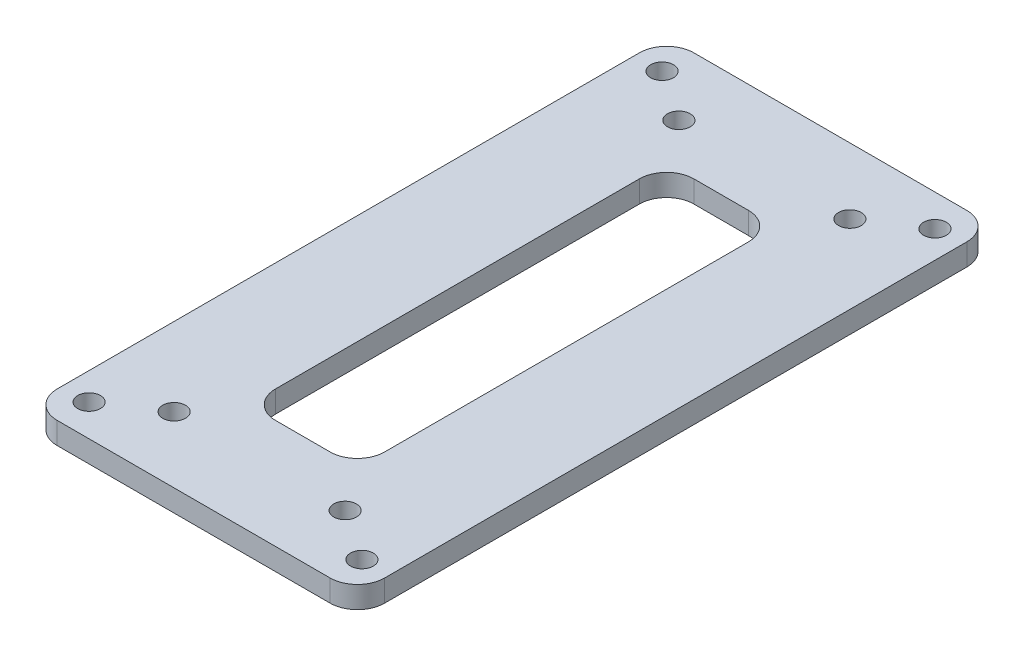
from build123d import *

# Parameters (mm, degrees)
SKETCH_1_W      = 36
SKETCH_1_H      = 70
SKETCH_1_R      = 1.25
SKETCH_1_W_2    = 12
SKETCH_1_H_2    = 46
EXTRUDE_1_DEPTH = 2.4
FILLET_1_R      = 3


with BuildPart() as part:
    # 草图1 → 凸台-拉伸1 (new body)
    with BuildSketch(Plane(origin=(0, 0, 0), x_dir=(1, 0, 0), z_dir=(0, 1, 0))):
        Rectangle(SKETCH_1_W, SKETCH_1_H)
        with Locations(Location((-9.4, 27.75, 0), (0, 0, 270))):
            Circle(SKETCH_1_R, mode=Mode.SUBTRACT)
        with Locations(Location((9.4, 27.75, 0), (0, 0, 90))):
            Circle(SKETCH_1_R, mode=Mode.SUBTRACT)
        with Locations(Location((9.4, -27.75, 0), (0, 0, 270))):
            Circle(SKETCH_1_R, mode=Mode.SUBTRACT)
        with Locations(Location((-9.4, -27.75, 0), (0, 0, 90))):
            Circle(SKETCH_1_R, mode=Mode.SUBTRACT)
        with Locations(Location((-15, 31.5, 0), (0, 0, 270))):
            Circle(SKETCH_1_R, mode=Mode.SUBTRACT)
        with Locations(Location((15, 31.5, 0), (0, 0, 90))):
            Circle(SKETCH_1_R, mode=Mode.SUBTRACT)
        with Locations(Location((-15, -31.5, 0), (0, 0, 90))):
            Circle(SKETCH_1_R, mode=Mode.SUBTRACT)
        with Locations(Location((15, -31.5, 0), (0, 0, 270))):
            Circle(SKETCH_1_R, mode=Mode.SUBTRACT)
        Rectangle(SKETCH_1_W_2, SKETCH_1_H_2, mode=Mode.SUBTRACT)
    extrude(amount=EXTRUDE_1_DEPTH)

    # 圆角1
    fillet_1_edges = [part.edges().sort_by_distance(p)[0] for p in [
        (-6, 1.2, 23),
        (6, 1.2, 23),
        (6, 1.2, -23),
        (-6, 1.2, -23),
        (18, 1.2, 35),
        (-18, 1.2, 35),
        (-18, 1.2, -35),
        (18, 1.2, -35),
    ]]
    fillet(fillet_1_edges, radius=FILLET_1_R)


solid = part.part
